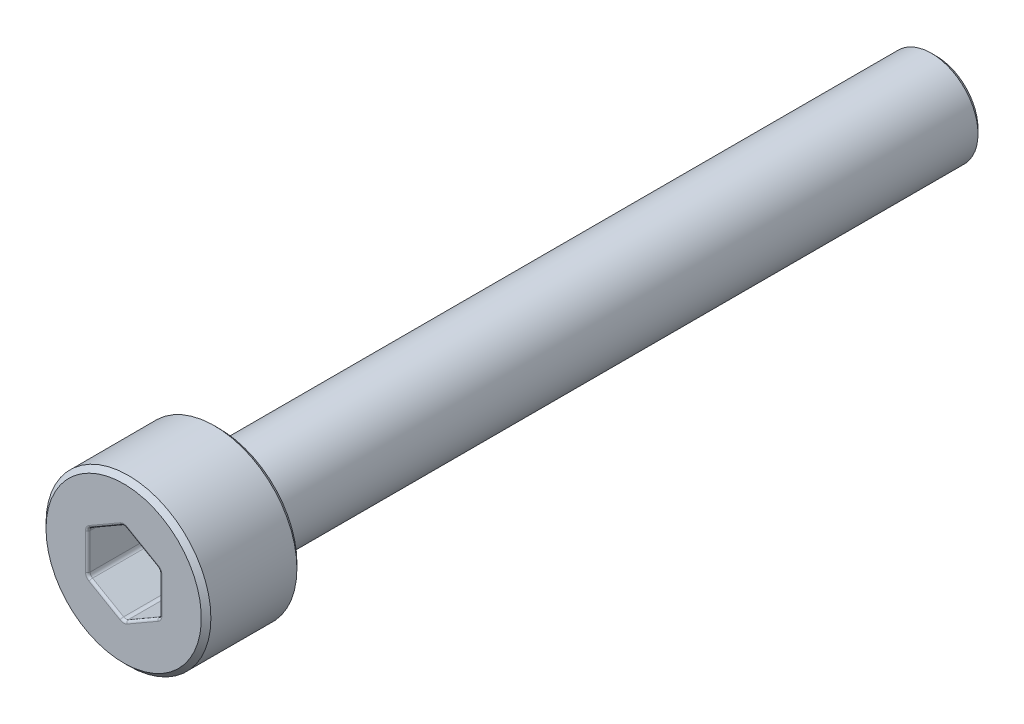
from build123d import *

# Parameters (mm, degrees)
SCHNITT_LINEAR_AUSTRAGEN1_DEPTH = 2.5
FASE1_SIZE                      = 0.2
VERRUNDUNG1_R                   = 0.2
VERRUNDUNG2_R                   = 0.1


with BuildPart() as part:
    # Skizze1 → Rotation1 (revolve)
    with BuildSketch(Plane(origin=(0, 0, 0), x_dir=(0, 0, -1), z_dir=(1, 0, 0))):
        Polygon((-4, 0), (-4, 3.45), (0, 3.45), (0, 1.95), (30, 1.95), (30, 0), align=None)
    revolve(axis=Axis((0, 0, 21.919879518), (0, 0, -1)))

    # Skizze2 → Schnitt-Linear austragen1 (cut)
    with BuildSketch(Plane.XY.offset(4)):
        Polygon((1.5, -0.866025404), (1.5, 0.866025404), (0, 1.732050808), (-1.5, 0.866025404), (-1.5, -0.866025404), (0, -1.732050808), align=None)
    extrude(amount=-SCHNITT_LINEAR_AUSTRAGEN1_DEPTH, mode=Mode.SUBTRACT)

    # Fase1
    fase1_edges = [part.edges().sort_by_distance(p)[0] for p in [
        (0, -3.45, 4),
        (0, -3.45, 0),
        (0, -1.95, -30),
    ]]
    chamfer(fase1_edges, length=FASE1_SIZE)

    # Verrundung1
    verrundung1_edges = [part.edges().sort_by_distance(p)[0] for p in [
        (-0.75, -1.299038106, 1.5),
        (-1.5, 0, 1.5),
        (-0.75, 1.299038106, 1.5),
        (0.75, 1.299038106, 1.5),
        (1.5, 0, 1.5),
        (0.75, -1.299038106, 1.5),
        (-1.5, -0.866025404, 2.75),
        (0, -1.732050808, 2.75),
        (1.5, -0.866025404, 2.75),
        (1.5, 0.866025404, 2.75),
        (0, 1.732050808, 2.75),
        (-1.5, 0.866025404, 2.75),
        (0, -1.95, 0),
    ]]
    fillet(verrundung1_edges, radius=VERRUNDUNG1_R)

    # Verrundung2
    verrundung2_edges = [part.edges().sort_by_distance(p)[0] for p in [
        (1.473205081, -0.85055535, 4),
        (0.75, -1.299038106, 4),
        (0, -1.7011107, 4),
        (-0.75, -1.299038106, 4),
        (-1.473205081, -0.85055535, 4),
        (-1.5, 0, 4),
        (-1.473205081, 0.85055535, 4),
        (-0.75, 1.299038106, 4),
        (0, 1.7011107, 4),
        (0.75, 1.299038106, 4),
        (1.473205081, 0.85055535, 4),
        (1.5, 0, 4),
    ]]
    fillet(verrundung2_edges, radius=VERRUNDUNG2_R)


solid = part.part
